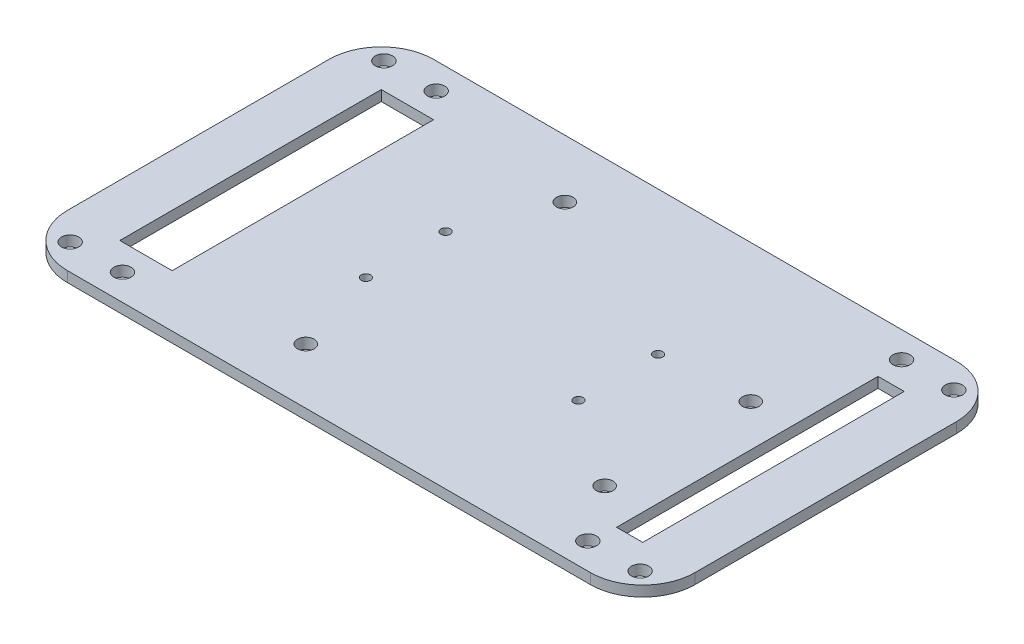
from build123d import *

# Parameters (mm, degrees)
PLANTAICEZUM_W          = 120
PLANTAICEZUM_H          = 70
PLANTAICEZUM_R          = 1.6
SALIENTE_EXTRUIR3_DEPTH = 2
REDONDEO1_R             = 10
REDONDEO2_R             = 10
REDONDEO3_R             = 10
REDONDEO4_R             = 10
CROQUIS1_W              = 10
CROQUIS1_H              = 50
CROQUIS1_W_2            = 5
CORTAR_EXTRUIR1_DEPTH   = 5
CROQUIS4_R              = 1.65
CORTAR_EXTRUIR2_DEPTH   = 5
CROQUIS6_R              = 0.9
CORTAR_EXTRUIR4_DEPTH   = 10


with BuildPart() as part:
    # PlantaIceZum → Saliente-Extruir3 (new body)
    with BuildSketch(Plane(origin=(0, 0, 0), x_dir=(1, 0, 0), z_dir=(0, 1, 0))):
        with Locations((60, 35)):
            Rectangle(PLANTAICEZUM_W, PLANTAICEZUM_H)
        with Locations(Location((97, 43.66, 0), (0, 0, 270))):
            Circle(PLANTAICEZUM_R, mode=Mode.SUBTRACT)
        with Locations(Location((46.2, 58.9, 0), (0, 0, 270))):
            Circle(PLANTAICEZUM_R, mode=Mode.SUBTRACT)
        with Locations(Location((44.93, 10.64, 0), (0, 0, 270))):
            Circle(PLANTAICEZUM_R, mode=Mode.SUBTRACT)
        with Locations(Location((97, 15.72, 0), (0, 0, 270))):
            Circle(PLANTAICEZUM_R, mode=Mode.SUBTRACT)
    extrude(amount=SALIENTE_EXTRUIR3_DEPTH)

    # Redondeo1
    redondeo1_edges = [part.edges().sort_by_distance(p)[0] for p in [
        (0, 1, 0),
    ]]
    fillet(redondeo1_edges, radius=REDONDEO1_R)

    # Redondeo2
    redondeo2_edges = [part.edges().sort_by_distance(p)[0] for p in [
        (0, 1, -70),
    ]]
    fillet(redondeo2_edges, radius=REDONDEO2_R)

    # Redondeo3
    redondeo3_edges = [part.edges().sort_by_distance(p)[0] for p in [
        (120, 1, -70),
    ]]
    fillet(redondeo3_edges, radius=REDONDEO3_R)

    # Redondeo4
    redondeo4_edges = [part.edges().sort_by_distance(p)[0] for p in [
        (120, 1, 0),
    ]]
    fillet(redondeo4_edges, radius=REDONDEO4_R)

    # Croquis1 → Cortar-Extruir1 (cut)
    with BuildSketch(Plane(origin=(0, 2, 0), x_dir=(1, 0, 0), z_dir=(0, 1, 0))):
        with Locations((15, 35)):
            Rectangle(CROQUIS1_W, CROQUIS1_H)
        with Locations((107.5, 35)):
            Rectangle(CROQUIS1_W_2, CROQUIS1_H)
    extrude(amount=-CORTAR_EXTRUIR1_DEPTH, mode=Mode.SUBTRACT)

    # Croquis4 → Cortar-Extruir2 (cut)
    with BuildSketch(Plane(origin=(0, 2, 0), x_dir=(1, 0, 0), z_dir=(0, 1, 0))):
        with Locations(Location((5.5, 65, 0), (0, 0, 270))):
            Circle(CROQUIS4_R)
        with Locations(Location((114.5, 65, 0), (0, 0, 270))):
            Circle(CROQUIS4_R)
        with Locations(Location((5.5, 5, 0), (0, 0, 270))):
            Circle(CROQUIS4_R)
        with Locations(Location((114.5, 5, 0), (0, 0, 270))):
            Circle(CROQUIS4_R)
        with Locations(Location((15.5, 65, 0), (0, 0, 270))):
            Circle(CROQUIS4_R)
        with Locations(Location((104.5, 65, 0), (0, 0, 270))):
            Circle(CROQUIS4_R)
        with Locations(Location((15.5, 5, 0), (0, 0, 270))):
            Circle(CROQUIS4_R)
        with Locations(Location((104.5, 5, 0), (0, 0, 270))):
            Circle(CROQUIS4_R)
    extrude(amount=-CORTAR_EXTRUIR2_DEPTH, mode=Mode.SUBTRACT)

    # Croquis6 → Cortar-Extruir4 (cut)
    with BuildSketch(Plane(origin=(0, 2, 0), x_dir=(1, 0, 0), z_dir=(0, 1, 0))):
        with Locations(Location((39.68, 42.62, 0), (0, 0, 270))):
            Circle(CROQUIS6_R)
        with Locations(Location((39.68, 27.38, 0), (0, 0, 270))):
            Circle(CROQUIS6_R)
        with Locations(Location((80.32, 42.62, 0), (0, 0, 270))):
            Circle(CROQUIS6_R)
        with Locations(Location((80.32, 27.38, 0), (0, 0, 270))):
            Circle(CROQUIS6_R)
    extrude(amount=-CORTAR_EXTRUIR4_DEPTH, mode=Mode.SUBTRACT)


solid = part.part
